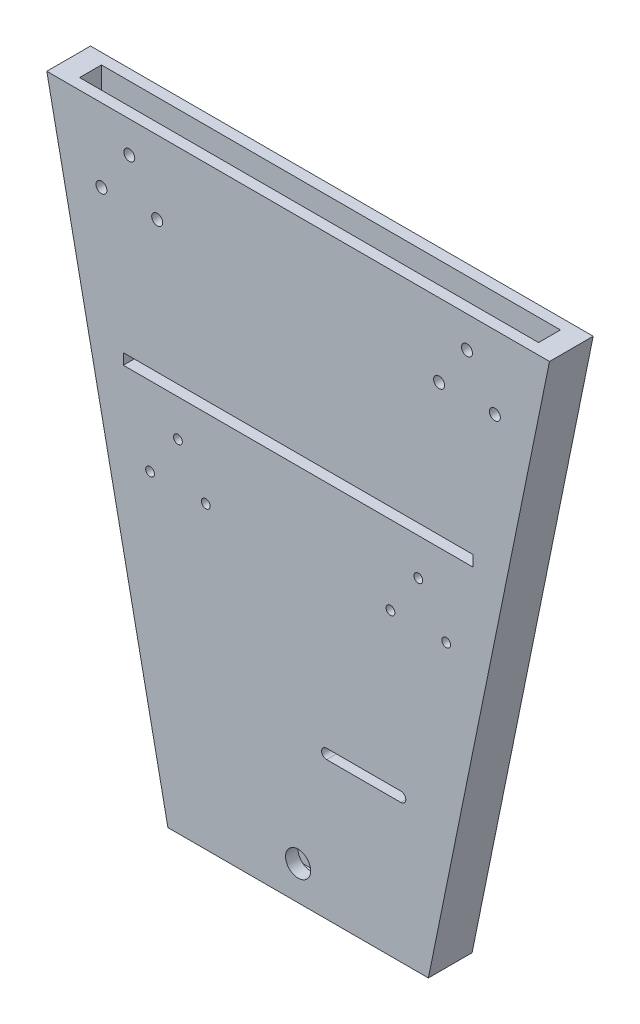
from build123d import *

# Parameters (mm, degrees)
EXTRUDE_1_DEPTH     = 20
SKETCH_3_W          = 210
SKETCH_3_H          = 10
CUT_EXTRUDE_1_DEPTH = 15
SKETCH_4_W          = 160
SKETCH_4_H          = 5
CUT_EXTRUDE_2_DEPTH = 10
SKETCH_5_R          = 2.5
SKETCH_5_R_2        = 2
CUT_EXTRUDE_3_DEPTH = 10
CUT_EXTRUDE_4_DEPTH = 4.3
SKETCH_8_R          = 5.75
CUT_EXTRUDE_6_DEPTH = 15
CUT_EXTRUDE_7_DEPTH = 250.048188108
CUT_EXTRUDE_START   = -8
CUT_EXTRUDE_8_DEPTH = 8


with BuildPart() as part:
    # 草图1 → 凸台-拉伸1 (new body)
    with BuildSketch(Plane.XY):
        Polygon((-115, 220), (115, 220), (60, -50), (59.592592593, -52), (-59.592592593, -52), (-60, -50), align=None)
    extrude(amount=EXTRUDE_1_DEPTH)

    # 草图3 → 切除-拉伸1 (cut)
    with BuildSketch(Plane(origin=(0, 220, 0), x_dir=(1, 0, 0), z_dir=(0, 1, 0))):
        with Locations((0, -10)):
            Rectangle(SKETCH_3_W, SKETCH_3_H)
    extrude(amount=-CUT_EXTRUDE_1_DEPTH, mode=Mode.SUBTRACT)

    # 草图4 → 切除-拉伸2 (cut)
    with BuildSketch(Plane.XY.offset(20)):
        with Locations((0, 123.51)):
            Rectangle(SKETCH_4_W, SKETCH_4_H)
    extrude(amount=-CUT_EXTRUDE_2_DEPTH, mode=Mode.SUBTRACT)

    # 草图5 → 切除-拉伸3 (cut)
    with BuildSketch(Plane.XY.offset(20)):
        with Locations((-77.25, 205.6425573)):
            Circle(SKETCH_5_R)
        with Locations((-90, 186.5)):
            Circle(SKETCH_5_R)
        with Locations((-64.5, 186.5)):
            Circle(SKETCH_5_R)
        with Locations((-55, 104.1525573)):
            Circle(SKETCH_5_R_2)
        with Locations((-67.75, 85.01)):
            Circle(SKETCH_5_R_2)
        with Locations((-42.25, 85.01)):
            Circle(SKETCH_5_R_2)
        with Locations(Location((42.25, 85.01, 0), (0, 0, 180))):
            Circle(SKETCH_5_R_2)
        with Locations(Location((67.75, 85.01, 0), (0, 0, 180))):
            Circle(SKETCH_5_R_2)
        with Locations(Location((55, 104.1525573, 0), (0, 0, 180))):
            Circle(SKETCH_5_R_2)
        with Locations(Location((64.5, 186.5, 0), (0, 0, 180))):
            Circle(SKETCH_5_R)
        with Locations(Location((90, 186.5, 0), (0, 0, 180))):
            Circle(SKETCH_5_R)
        with Locations(Location((77.25, 205.6425573, 0), (0, 0, 345.106514196))):
            Circle(SKETCH_5_R)
    extrude(amount=-CUT_EXTRUDE_3_DEPTH, mode=Mode.SUBTRACT)

    # 草图6 → 切除-拉伸4 (cut, symmetric)
    with BuildSketch(Plane(origin=(0, 0, 10), x_dir=(-1, 0, 0), z_dir=(0, 0, -1))):
        with BuildLine():
            Line((0, -49.69), (17.486671343, -49.69))
            Line((17.486671343, -49.69), (12.108893566, -23.29))
            Line((12.108893566, -23.29), (0, -23.29))
            ThreePointArc((0, -23.29), (-13.2, -36.49), (0, -49.69))
        make_face()
    extrude(amount=CUT_EXTRUDE_4_DEPTH, both=True, mode=Mode.SUBTRACT)

    # 草图8 → 切除-拉伸6 (cut)
    with BuildSketch(Plane.XY.offset(20)):
        with Locations((0, -36.49)):
            Circle(SKETCH_8_R)
    extrude(amount=-CUT_EXTRUDE_6_DEPTH, mode=Mode.SUBTRACT)

    # 草图9 → 切除-拉伸7 (cut, through all)
    with BuildSketch(Plane.XY.offset(20)):
        with BuildLine():
            Line((13, 11.26), (47, 11.26))
            ThreePointArc((47, 11.26), (49.25, 13.51), (47, 15.76))
            Line((47, 15.76), (13, 15.76))
            ThreePointArc((13, 15.76), (10.75, 13.51), (13, 11.26))
        make_face()
    extrude(amount=-CUT_EXTRUDE_7_DEPTH, mode=Mode.SUBTRACT)

    # 草图10 → 切除-拉伸8 (cut)
    with BuildSketch(Plane(origin=(0, 0, 0), x_dir=(-1, 0, 0), z_dir=(0, 0, -1)).offset(CUT_EXTRUDE_START)):
        with BuildLine():
            Line((-50, 9.51), (-10, 9.51))
            ThreePointArc((-10, 9.51), (-6, 13.51), (-10, 17.51))
            Line((-10, 17.51), (-50, 17.51))
            ThreePointArc((-50, 17.51), (-54, 13.51), (-50, 9.51))
        make_face()
        with BuildLine():
            Line((-47, 15.76), (-13, 15.76))
            ThreePointArc((-13, 15.76), (-10.75, 13.51), (-13, 11.26))
            Line((-13, 11.26), (-47, 11.26))
            ThreePointArc((-47, 11.26), (-49.25, 13.51), (-47, 15.76))
        make_face(mode=Mode.SUBTRACT)
    extrude(amount=CUT_EXTRUDE_8_DEPTH, mode=Mode.SUBTRACT)


solid = part.part
